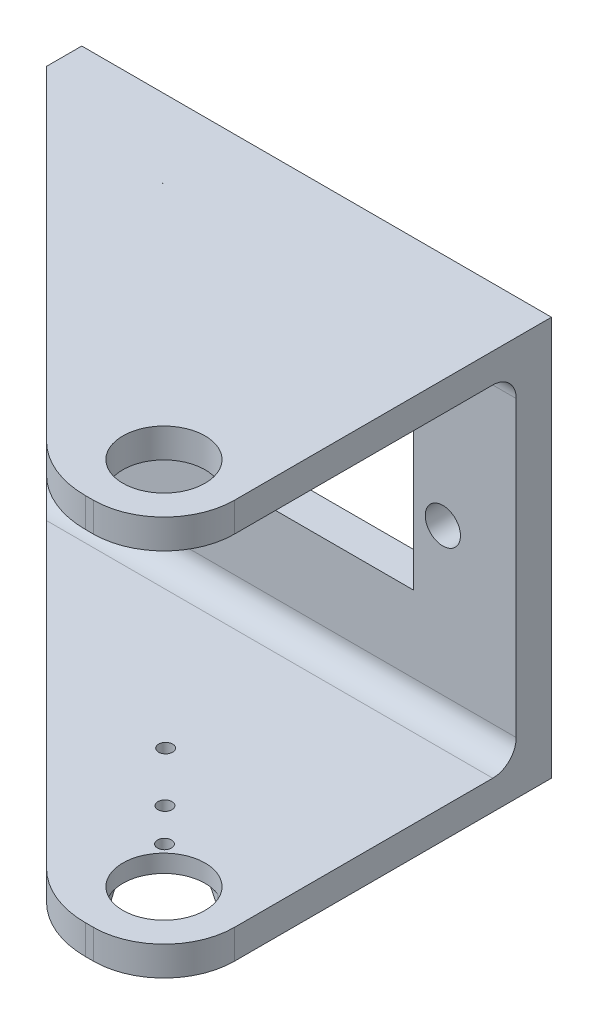
from build123d import *

# Parameters (mm, degrees)
ESBO_O1_W                  = 40
ESBO_O1_H                  = 34
ESBO_O1_R                  = 1.5
ESBO_O1_W_2                = 22.5
ESBO_O1_H_2                = 12
RESSALTO_EXTRUS_O1_DEPTH   = 3
ESBO_O2_W                  = 40
ESBO_O2_H                  = 2.5
RESSALTO_EXTRUS_O2_DEPTH   = 30
CORTE_EXTRUS_O1_DEPTH      = 53.282720471
CORTE_EXTRUS_O1_DEPTH_BACK = 53.282720471
ESBO_O3_R                  = 3.5
FILETE1_R                  = 6
FILETE2_R                  = 2
CORTE_EXTRUS_O2_DEPTH      = 1
FILETE4_R                  = 8
CORTE_EXTRUS_O3_REACH      = 53.638
ESBO_O5_R                  = 0.6


with BuildPart() as part:
    # Esboço1 → Ressalto-extrusão1 (new body)
    with BuildSketch(Plane.XY):
        with Locations((-2.101648352, 0.459478022)):
            Rectangle(ESBO_O1_W, ESBO_O1_H)
        with Locations((11.648351648, 0.459478022)):
            Circle(ESBO_O1_R, mode=Mode.SUBTRACT)
        with Locations(Location((-15.851648352, 0.459478022, 0), (0, 0, 180))):
            Circle(ESBO_O1_R, mode=Mode.SUBTRACT)
        with Locations((-2.101648352, 0.459478022)):
            Rectangle(ESBO_O1_W_2, ESBO_O1_H_2, mode=Mode.SUBTRACT)
    extrude(amount=RESSALTO_EXTRUS_O1_DEPTH)

    # Esboço2 → Ressalto-extrusão2 (add)
    with BuildSketch(Plane.XY.offset(3)):
        with Locations((-2.101648352, 16.209478022)):
            Rectangle(ESBO_O2_W, ESBO_O2_H)
        with Locations((-2.101648352, -15.290521978)):
            Rectangle(ESBO_O2_W, ESBO_O2_H)
    extrude(amount=RESSALTO_EXTRUS_O2_DEPTH)

    # Esboço3 → Corte-extrusão1 (cut, two sides: drawn at the far end of the back side and taken through both)
    with BuildSketch(Plane.XZ.offset(16.540521978).offset(-CORTE_EXTRUS_O1_DEPTH_BACK)):
        with Locations(Location((11.898351648, 27, 0), (0, 0, 270))):
            Circle(ESBO_O3_R)
        Polygon((-22.101648352, 3), (7.898351648, 33), (-22.101648352, 33), align=None)
    extrude(amount=CORTE_EXTRUS_O1_DEPTH + CORTE_EXTRUS_O1_DEPTH_BACK, mode=Mode.SUBTRACT)

    # Filete1
    filete1_edges = [part.edges().sort_by_distance(p)[0] for p in [
        (17.898351648, 16.209478022, 33),
        (17.898351648, -15.290521978, 33),
    ]]
    fillet(filete1_edges, radius=FILETE1_R)

    # Filete2
    filete2_edges = [part.edges().sort_by_distance(p)[0] for p in [
        (-2.101648352, 14.959478022, 3),
        (-2.101648352, -14.040521978, 3),
    ]]
    fillet(filete2_edges, radius=FILETE2_R)

    # Esboço4 → Corte-extrusão2 (cut)
    with BuildSketch(Plane.XZ.offset(16.540521978)):
        with BuildLine():
            Line((5.173317787, 23.74427083), (-1.45414508, 17.053728929))
            Line((-1.45414508, 17.053728929), (1.905973753, 13.7252896))
            Line((1.905973753, 13.7252896), (8.413154378, 20.294404433))
            ThreePointArc((8.413154378, 20.294404433), (9.16091607, 20.97650137), (9.973796219, 21.579518488))
            Line((9.973796219, 21.579518488), (13.290279513, 23.788686123))
            Line((13.290279513, 23.788686123), (11.68978022, 23.506220104))
            Line((11.68978022, 23.506220104), (8.398351648, 27))
            Line((8.398351648, 27), (8.903771348, 28.811764009))
            Line((8.903771348, 28.811764009), (6.253622951, 25.036396208))
            ThreePointArc((6.253622951, 25.036396208), (5.740721803, 24.367549457), (5.173317787, 23.74427083))
        make_face()
    extrude(amount=-CORTE_EXTRUS_O2_DEPTH, mode=Mode.SUBTRACT)

    # Filete4
    filete4_edges = [part.edges().sort_by_distance(p)[0] for p in [
        (7.898351648, -15.290521978, 33),
        (7.898351648, 16.209478022, 33),
    ]]
    fillet(filete4_edges, radius=FILETE4_R)

    # Esboço5 → Corte-extrusão3 (cut, up to next)
    with BuildSketch(Plane(origin=(0, -15.540521978, 0), x_dir=(-1, 0, 0), z_dir=(0, -1, 0)), mode=Mode.PRIVATE) as corte_extrus_o3_sk1:
        with Locations(Location((-8.774251962, -23.831009443, 0), (0, 0, 180))):
            Circle(ESBO_O5_R)
    corte_extrus_o3_tool1 = extrude(corte_extrus_o3_sk1.sketch, amount=-CORTE_EXTRUS_O3_REACH, mode=Mode.PRIVATE) & part.part
    # Esboço5 → Corte-extrusão3 (cut, up to next)
    with BuildSketch(Plane(origin=(0, -15.540521978, 0), x_dir=(-1, 0, 0), z_dir=(0, -1, 0)), mode=Mode.PRIVATE) as corte_extrus_o3_sk2:
        with Locations(Location((-5.966072468, -20.982478606, 0), (0, 0, 180))):
            Circle(ESBO_O5_R)
    corte_extrus_o3_tool2 = extrude(corte_extrus_o3_sk2.sketch, amount=-CORTE_EXTRUS_O3_REACH, mode=Mode.PRIVATE) & part.part
    # Esboço5 → Corte-extrusão3 (cut, up to next)
    with BuildSketch(Plane(origin=(0, -15.540521978, 0), x_dir=(-1, 0, 0), z_dir=(0, -1, 0)), mode=Mode.PRIVATE) as corte_extrus_o3_sk3:
        with Locations(Location((-1.753803228, -16.70968235, 0), (0, 0, 180))):
            Circle(ESBO_O5_R)
    corte_extrus_o3_tool3 = extrude(corte_extrus_o3_sk3.sketch, amount=-CORTE_EXTRUS_O3_REACH, mode=Mode.PRIVATE) & part.part
    add(corte_extrus_o3_tool1.solids().sort_by_distance((8.774252, -15.540522, 23.831009))[0], mode=Mode.SUBTRACT)
    add(corte_extrus_o3_tool2.solids().sort_by_distance((5.966072, -15.540522, 20.982479))[0], mode=Mode.SUBTRACT)
    add(corte_extrus_o3_tool3.solids().sort_by_distance((1.753803, -15.540522, 16.709682))[0], mode=Mode.SUBTRACT)


solid = part.part
